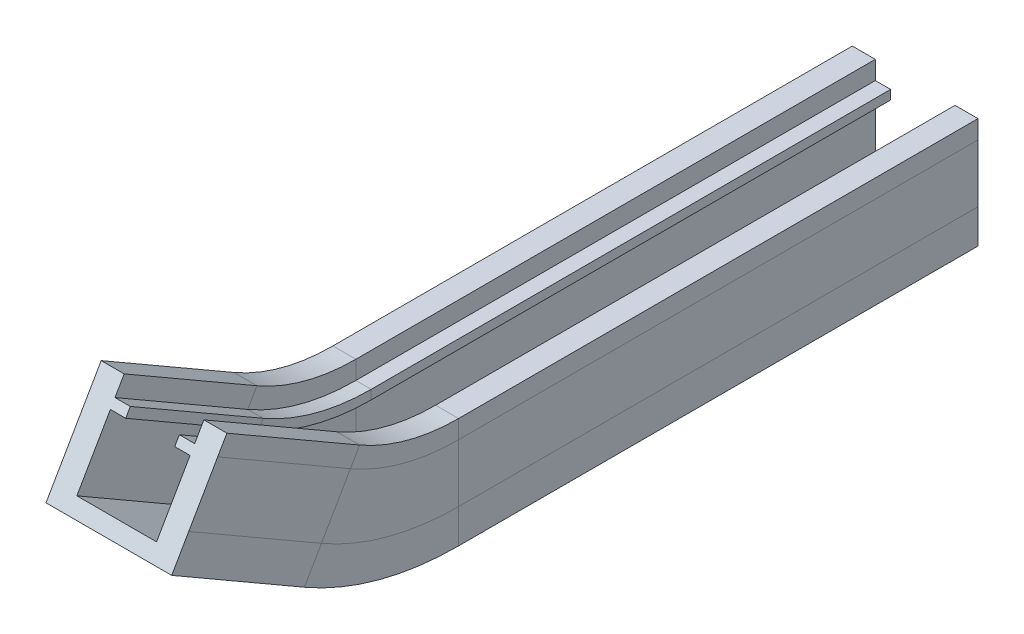
from build123d import *


with BuildPart() as part:
    # 扫描2: sweep along a path in 草图3
    with BuildLine(Plane(origin=(0, 0, 0), x_dir=(0, 0, -1), z_dir=(1, 0, 0))) as sweep_2_path:
        Line((0, -36.524100396), (-338.88345961, -36.524100396))
        ThreePointArc((-338.88345961, -36.524100396), (-380.294506826, -31.072232602), (-418.88345961, -15.088165001))
        Line((-418.88345961, -15.088165001), (-505.485999988, 34.911834999))
    # 草图2 → 扫描2 (sweep)
    with BuildSketch(Plane.XY):
        Polygon((-41, -55.412292473), (-41, -77.635908318), (41, -77.635908318), (41, -55.412292473), (41, -17.635908318), (41, -5.635908318), (26, -5.635908318), (26, -17.635908318), (16, -17.635908318), (16, -23.635908318), (26, -23.635908318), (26, -67.384306902), (-26, -67.384306902), (-26, -23.635908318), (-16, -23.635908318), (-16, -17.635908318), (-26, -17.635908318), (-26, -5.635908318), (-41, -5.635908318), (-41, -17.635908318), align=None)
    sweep(path=sweep_2_path.line)


solid = part.part
